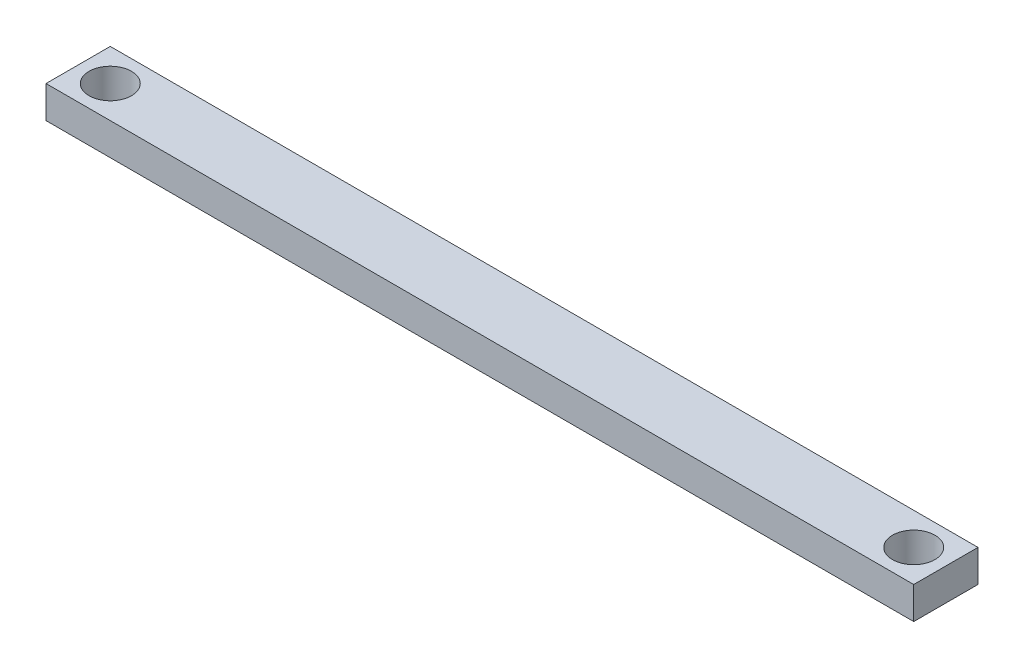
from build123d import *

# Parameters (mm, degrees)
SKETCH_1_W      = 675
SKETCH_1_H      = 50
SKETCH_1_R      = 16.5
EXTRUDE_1_DEPTH = 25


with BuildPart() as part:
    # 草图1 → 凸台-拉伸1 (new body)
    with BuildSketch(Plane(origin=(0, 0, 0), x_dir=(1, 0, 0), z_dir=(0, 1, 0))):
        with Locations((337.5, 25)):
            Rectangle(SKETCH_1_W, SKETCH_1_H)
        with Locations(Location((25, 25, 0), (0, 0, 270))):
            Circle(SKETCH_1_R, mode=Mode.SUBTRACT)
        with Locations(Location((650, 25, 0), (0, 0, 270))):
            Circle(SKETCH_1_R, mode=Mode.SUBTRACT)
    extrude(amount=EXTRUDE_1_DEPTH)


solid = part.part
